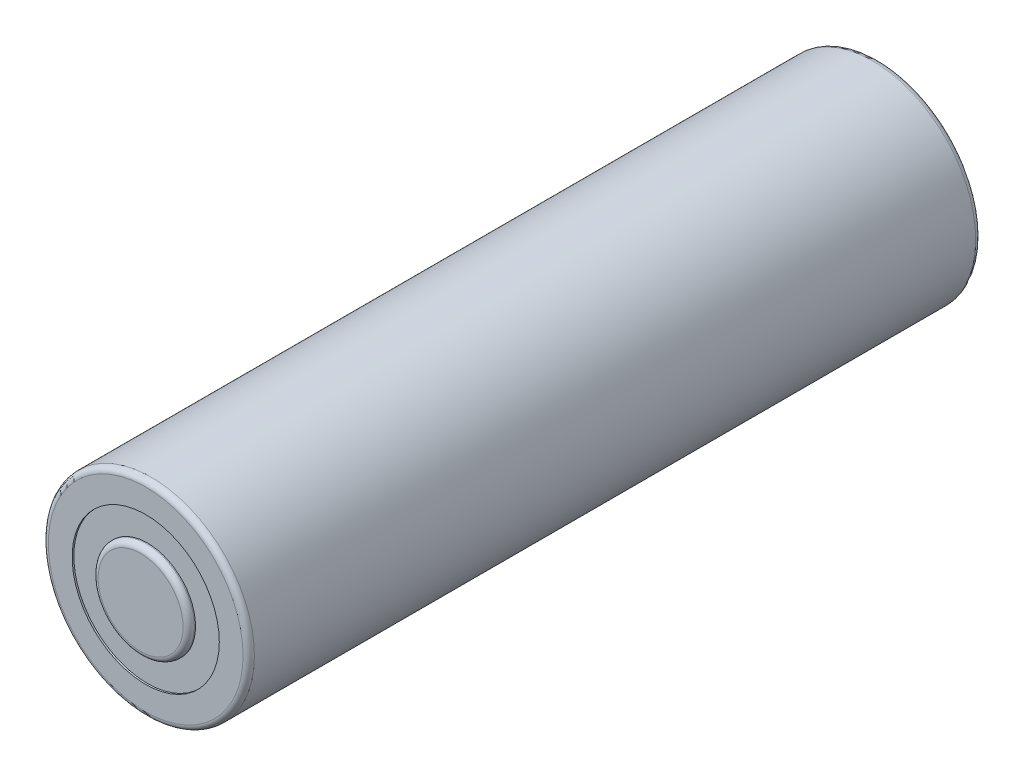
from build123d import *

# Parameters (mm, degrees)
SKETCH_1_R          = 9.1
EXTRUDE_1_DEPTH     = 64.7
FILLET_1_R          = 0.5
FILLET_2_R          = 0.5
SKETCH_2_R          = 6.5
CUT_EXTRUDE_1_DEPTH = 0.35
CUT_EXTRUDE_START   = -0.35
SKETCH_3_R          = 6.5
CUT_EXTRUDE_2_DEPTH = 0.35
SKETCH_4_R          = 4.25
EXTRUDE_2_DEPTH     = 0.8
FILLET_3_R          = 0.5
SKETCH_5_R          = 6.5
SKETCH_5_R_2        = 4.25
EXTRUDE_3_DEPTH     = 0.2


with BuildPart() as part:
    # 草图1 → 凸台-拉伸1 (new body)
    with BuildSketch(Plane.XY):
        with Locations(Location((-28.874360447, 15.271996124, 0), (0, 0, 180))):
            Circle(SKETCH_1_R)
    extrude(amount=EXTRUDE_1_DEPTH)

    # 圆角1
    fillet_1_edges = [part.edges().sort_by_distance(p)[0] for p in [
        (-19.774360447, 15.271996124, 0),
    ]]
    fillet(fillet_1_edges, radius=FILLET_1_R)

    # 圆角2
    fillet_2_edges = [part.edges().sort_by_distance(p)[0] for p in [
        (-19.774360447, 15.271996124, 64.7),
    ]]
    fillet(fillet_2_edges, radius=FILLET_2_R)

    # 草图2 → 切除-拉伸1 (cut)
    with BuildSketch(Plane(origin=(0, 0, 0), x_dir=(-1, 0, 0), z_dir=(0, 0, -1))):
        with Locations((28.874360447, 15.271996124)):
            Circle(SKETCH_2_R)
    extrude(amount=-CUT_EXTRUDE_1_DEPTH, mode=Mode.SUBTRACT)

    # 草图3 → 切除-拉伸2 (cut)
    with BuildSketch(Plane.XY.offset(64.7).offset(CUT_EXTRUDE_START)):
        with Locations(Location((-28.874360447, 15.271996124, 0), (0, 0, 180))):
            Circle(SKETCH_3_R)
    extrude(amount=CUT_EXTRUDE_2_DEPTH, mode=Mode.SUBTRACT)

    # 草图4 → 凸台-拉伸2 (add)
    with BuildSketch(Plane.XY.offset(64.35)):
        with Locations((-28.874360447, 15.271996124)):
            Circle(SKETCH_4_R)
    extrude(amount=EXTRUDE_2_DEPTH)

    # 圆角3
    fillet_3_edges = [part.edges().sort_by_distance(p)[0] for p in [
        (-33.124360447, 15.271996124, 65.15),
    ]]
    fillet(fillet_3_edges, radius=FILLET_3_R)

    # 草图5 → 凸台-拉伸3 (add)
    with BuildSketch(Plane.XY.offset(64.35)):
        with Locations(Location((-28.874360447, 15.271996124, 0), (0, 0, 180))):
            Circle(SKETCH_5_R)
        with Locations((-28.874360447, 15.271996124)):
            Circle(SKETCH_5_R_2, mode=Mode.SUBTRACT)
    extrude(amount=EXTRUDE_3_DEPTH)


solid = part.part
